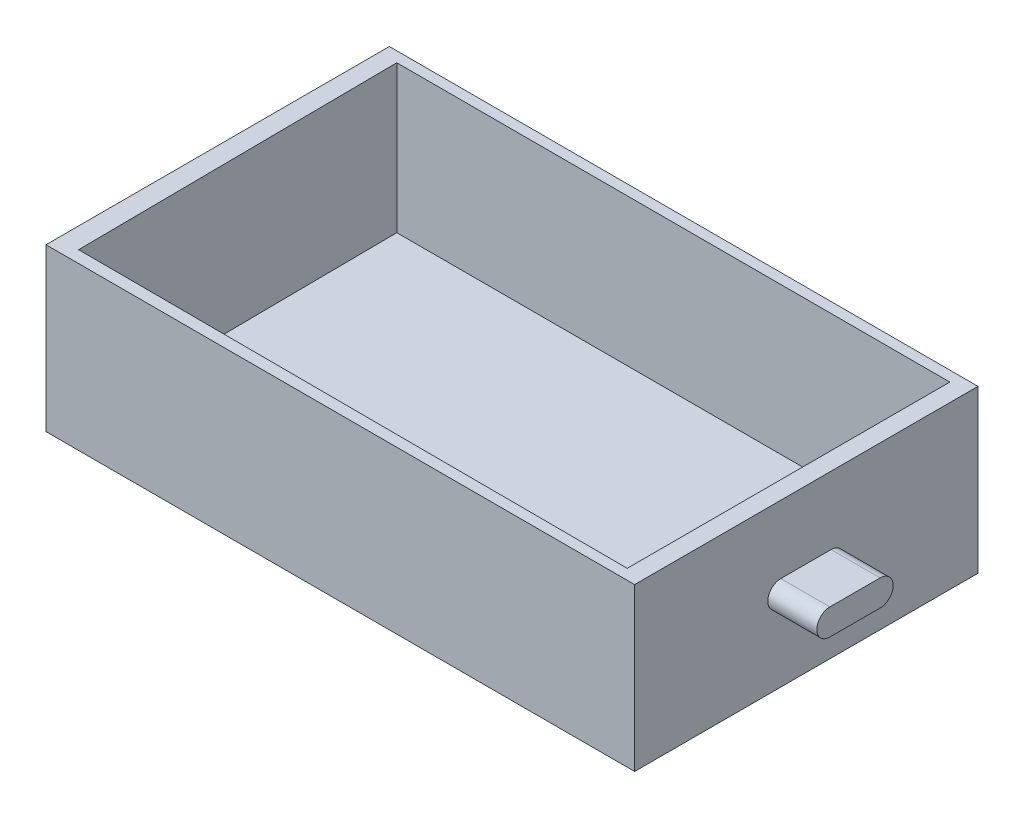
from build123d import *

# Parameters (mm, degrees)
SKETCH_1_W      = 120
SKETCH_1_H      = 70
EXTRUDE_1_DEPTH = 3
SKETCH_3_W      = 120
SKETCH_3_H      = 70
EXTRUDE_2_DEPTH = 33
EXTRUDE_3_DEPTH = 10


with BuildPart() as part:
    # 草图1 → 凸台-拉伸1 (new body)
    with BuildSketch(Plane(origin=(0, 0, 0), x_dir=(1, 0, 0), z_dir=(0, 1, 0))):
        Rectangle(SKETCH_1_W, SKETCH_1_H)
    extrude(amount=EXTRUDE_1_DEPTH)

    # 草图3 → 凸台-拉伸2 (add)
    with BuildSketch(Plane(origin=(0, 0, 0), x_dir=(1, 0, 0), z_dir=(0, 1, 0))):
        Rectangle(SKETCH_3_W, SKETCH_3_H)
        Polygon((-56.372128616, 32.883741693), (56.372128616, 32.883741693), (56.372128616, -32.883741693), (-55.8, -32.55), align=None, mode=Mode.SUBTRACT)
    extrude(amount=EXTRUDE_2_DEPTH)

    # 草图4 → 凸台-拉伸3 (add)
    with BuildSketch(Plane(origin=(60, 0, 0), x_dir=(0, 0, -1), z_dir=(1, 0, 0))):
        with BuildLine():
            Line((-5.198866843, 19.159885362), (5.03766167, 19.159885362))
            ThreePointArc((5.03766167, 19.159885362), (7.697547031, 16.5), (5.03766167, 13.840114638))
            Line((5.03766167, 13.840114638), (-5.198866843, 13.840114638))
            ThreePointArc((-5.198866843, 13.840114638), (-7.858752205, 16.5), (-5.198866843, 19.159885362))
        make_face()
    extrude(amount=EXTRUDE_3_DEPTH)


solid = part.part
